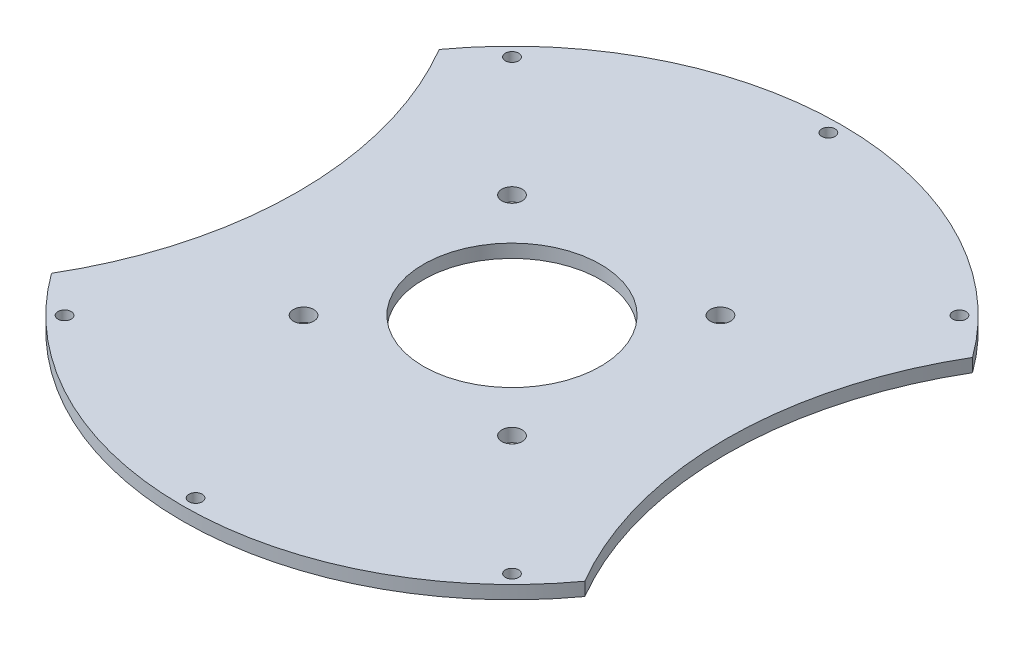
from build123d import *

# Parameters (mm, degrees)
SKETCH_2_R      = 1.5
SKETCH_2_R_2    = 20
SKETCH_2_R_3    = 2.3
EXTRUDE_1_DEPTH = 3


with BuildPart() as part:
    # 草图2 → 凸台-拉伸1 (new body)
    with BuildSketch(Plane(origin=(0, 0, 0), x_dir=(1, 0, 0), z_dir=(0, 1, 0))):
        with BuildLine():
            ThreePointArc((60.260378076, 43.805671256), (0, 74.5), (-60.260378076, 43.805671256))
            ThreePointArc((-60.260378076, 43.805671256), (-48.360726818, 0), (-60.260378076, -43.805671256))
            ThreePointArc((-60.260378076, -43.805671256), (0, -74.5), (60.260378076, -43.805671256))
            ThreePointArc((60.260378076, -43.805671256), (48.360726818, 0), (60.260378076, 43.805671256))
        make_face()
        with Locations(Location((0, 71.5, 0), (0, 0, 270))):
            Circle(SKETCH_2_R, mode=Mode.SUBTRACT)
        with Locations(Location((50.558134855, 50.558134855, 0), (0, 0, 270))):
            Circle(SKETCH_2_R, mode=Mode.SUBTRACT)
        with Locations(Location((50.558134855, -50.558134855, 0), (0, 0, 270))):
            Circle(SKETCH_2_R, mode=Mode.SUBTRACT)
        with Locations(Location((0, -71.5, 0), (0, 0, 270))):
            Circle(SKETCH_2_R, mode=Mode.SUBTRACT)
        with Locations(Location((-50.558134855, -50.558134855, 0), (0, 0, 270))):
            Circle(SKETCH_2_R, mode=Mode.SUBTRACT)
        with Locations(Location((-50.558134855, 50.558134855, 0), (0, 0, 270))):
            Circle(SKETCH_2_R, mode=Mode.SUBTRACT)
        with Locations(Location((0, 0, 0), (0, 0, 270))):
            Circle(SKETCH_2_R_2, mode=Mode.SUBTRACT)
        with Locations(Location((-23.55, 23.55, 0), (0, 0, 270))):
            Circle(SKETCH_2_R_3, mode=Mode.SUBTRACT)
        with Locations(Location((23.55, 23.55, 0), (0, 0, 270))):
            Circle(SKETCH_2_R_3, mode=Mode.SUBTRACT)
        with Locations(Location((23.55, -23.55, 0), (0, 0, 270))):
            Circle(SKETCH_2_R_3, mode=Mode.SUBTRACT)
        with Locations(Location((-23.55, -23.55, 0), (0, 0, 270))):
            Circle(SKETCH_2_R_3, mode=Mode.SUBTRACT)
    extrude(amount=EXTRUDE_1_DEPTH)


solid = part.part
